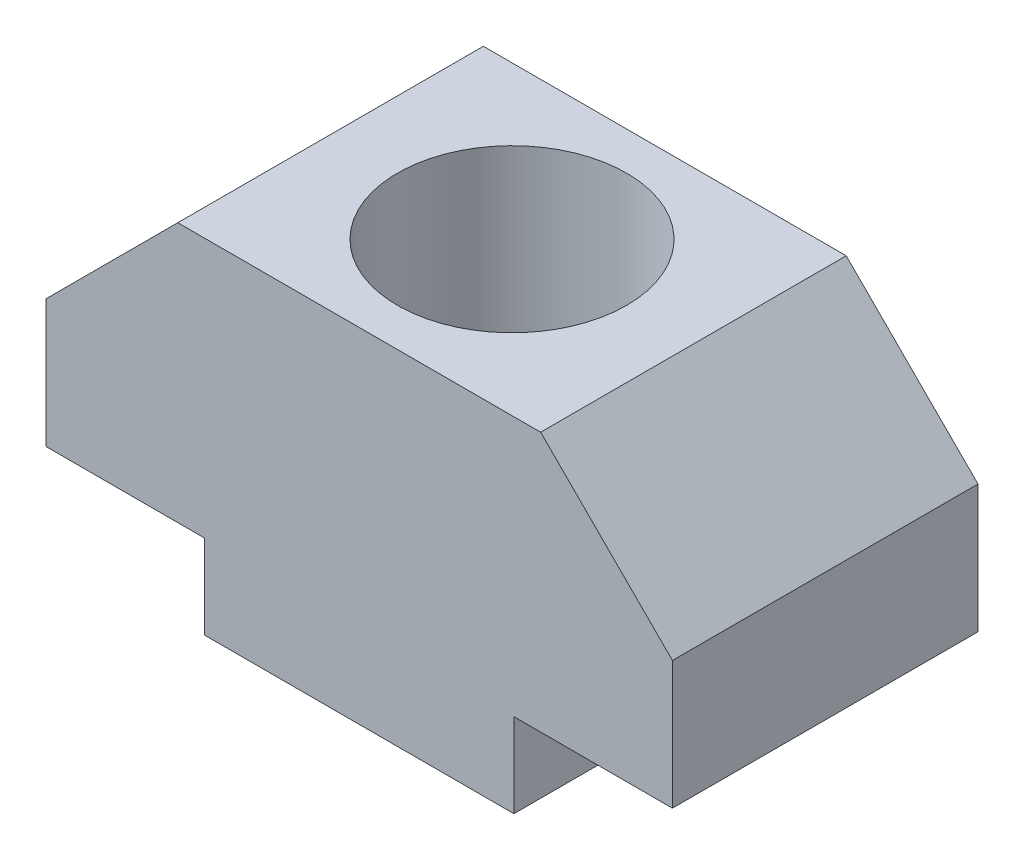
from build123d import *

# Parameters (mm, degrees)
EXTRUDE1_DEPTH     = 4
CUT_EXTRUDE1_REACH = 14.816
SKETCH2_R          = 3


with BuildPart() as part:
    # Sketch1 → Extrude1 (new, symmetric)
    with BuildSketch(Plane.XY):
        Polygon((-4.05, 0), (4.05, 0), (4.05, 2.2), (8.2, 2.2), (8.2, 5.55), (4.75, 9), (-4.75, 9), (-8.2, 5.55), (-8.2, 2.2), (-4.05, 2.2), align=None)
    extrude(amount=EXTRUDE1_DEPTH, both=True)

    # Sketch2 → Cut-Extrude1 (cut, up to next)
    with BuildSketch(Plane(origin=(0, 0, 0), x_dir=(1, 0, 0), z_dir=(0, 1, 0)), mode=Mode.PRIVATE) as cut_extrude1_sk1:
        Circle(SKETCH2_R)
    cut_extrude1_tool1 = extrude(cut_extrude1_sk1.sketch, amount=CUT_EXTRUDE1_REACH, mode=Mode.PRIVATE) & part.part
    add(cut_extrude1_tool1.solids().sort_by_distance((0, 0, 0))[0], mode=Mode.SUBTRACT)


solid = part.part
